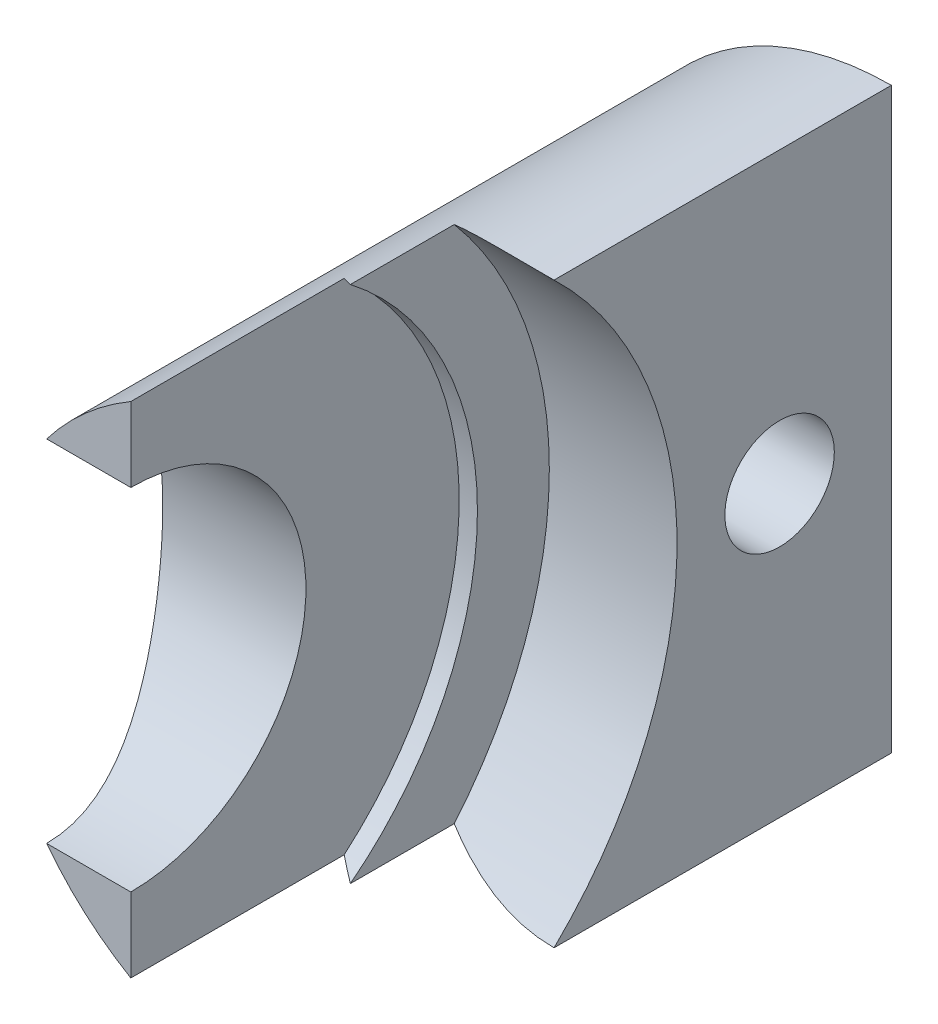
from build123d import *

# Parameters (mm, degrees)
SKETCH1_R               = 7.925
EXTRUDE1_DEPTH          = 16.84375
CUT_EXTRUDE1_DEPTH      = 21.231736556
CUT_EXTRUDE1_DEPTH_BACK = 21.231736556
SKETCH2_W               = 7.925
SKETCH2_H               = 17
SKETCH3_R               = 11
CUT_EXTRUDE2_DEPTH      = 3.5
SKETCH6_R               = 9
CUT_EXTRUDE5_DEPTH      = 4
SKETCH7_R               = 4.8
SKETCH7_R_2             = 1.5
CUT_EXTRUDE6_DEPTH      = 21.231736717


with BuildPart() as part:
    # Sketch1 → Extrude1 (new body)
    with BuildSketch(Plane.XY):
        Circle(SKETCH1_R)
    extrude(amount=EXTRUDE1_DEPTH)

    # Sketch2 → Cut-Extrude1 (cut, two sides: drawn at the far end of the back side and taken through both)
    with BuildSketch(Plane(origin=(0, 0, 0), x_dir=(1, 0, 0), z_dir=(0, 1, 0)).offset(-CUT_EXTRUDE1_DEPTH_BACK)):
        with Locations((3.9625, -8.5)):
            Rectangle(SKETCH2_W, SKETCH2_H)
    extrude(amount=CUT_EXTRUDE1_DEPTH + CUT_EXTRUDE1_DEPTH_BACK, mode=Mode.SUBTRACT)

    # Sketch3 → Cut-Extrude2 (cut)
    with BuildSketch(Plane(origin=(0, 0, 0), x_dir=(0, 0, -1), z_dir=(1, 0, 0))):
        with Locations((-16.873106172, 0)):
            Circle(SKETCH3_R)
    extrude(amount=-CUT_EXTRUDE2_DEPTH, mode=Mode.SUBTRACT)

    # Sketch6 → Cut-Extrude5 (cut)
    with BuildSketch(Plane(origin=(0, 0, 0), x_dir=(0, 0, -1), z_dir=(1, 0, 0))):
        with Locations((-16.84375, 0)):
            Circle(SKETCH6_R)
    extrude(amount=-CUT_EXTRUDE5_DEPTH, mode=Mode.SUBTRACT)

    # Sketch7 → Cut-Extrude6 (cut, through all)
    with BuildSketch(Plane(origin=(0, 0, 0), x_dir=(0, 0, -1), z_dir=(1, 0, 0))):
        with Locations((-16.84375, 0)):
            Circle(SKETCH7_R)
        with Locations((-3.0625, 0)):
            Circle(SKETCH7_R_2)
    extrude(amount=-CUT_EXTRUDE6_DEPTH, mode=Mode.SUBTRACT)


solid = part.part
